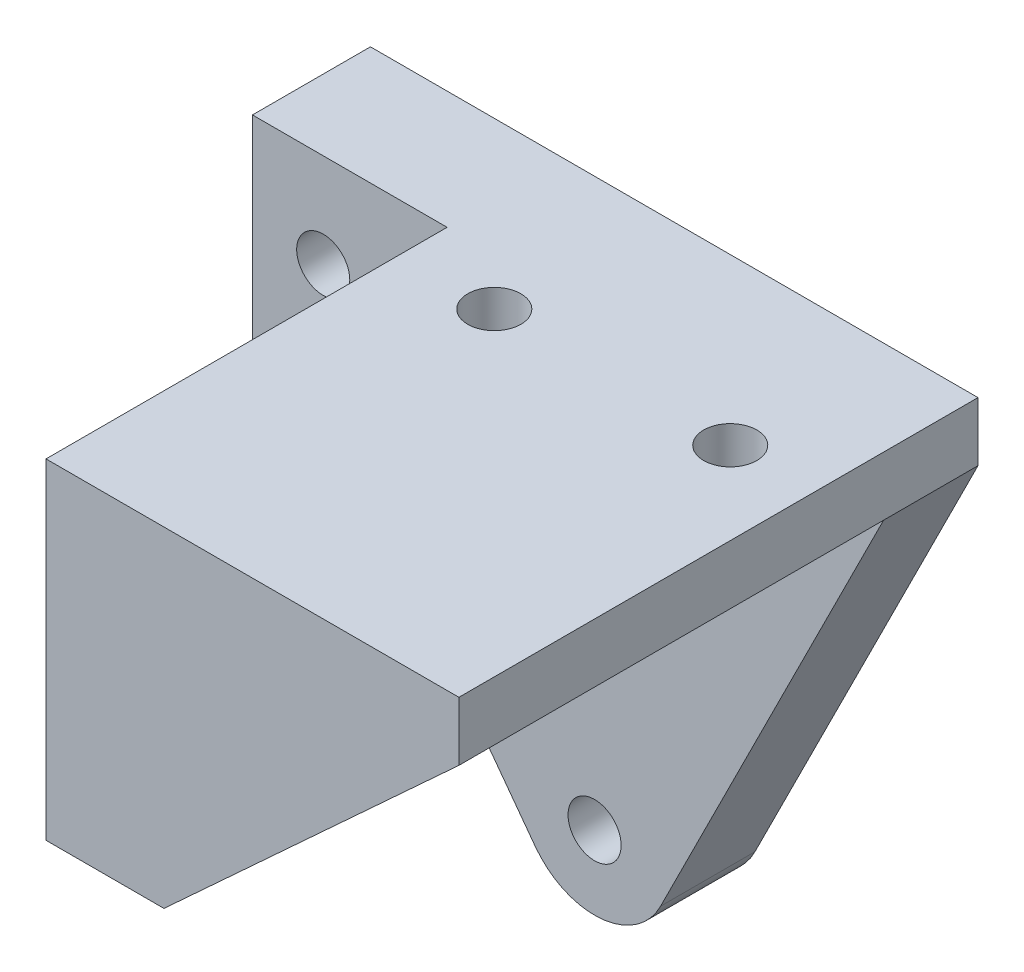
from build123d import *

# Parameters (mm, degrees)
BOSS_EXTRUDE1_DEPTH     = 28
BOSS_EXTRUDE2_DEPTH     = 12
SKETCH3_R               = 2.25
CUT_EXTRUDE1_DEPTH      = 62.565006294
SKETCH4_R               = 2.25
CUT_EXTRUDE2_DEPTH      = 56.554027757
SKETCH5_W               = 40
SKETCH5_H               = 5
BOSS_EXTRUDE3_DEPTH     = 25
CUT_EXTRUDE3_DEPTH      = 10
CUT_EXTRUDE3_DEPTH_BACK = 54.209491634
SKETCH6_R               = 2.25
SKETCH7_W               = 7
SKETCH7_H               = 5
CUT_EXTRUDE4_DEPTH      = 10
SKETCH8_R               = 2.25
BOSS_EXTRUDE4_DEPTH     = 8
BOSS_EXTRUDE6_DEPTH     = 4
SKETCH10_W              = 8
SKETCH10_H              = 28
CUT_EXTRUDE5_DEPTH      = 66.423619588


with BuildPart() as part:
    # Sketch1 → Boss-Extrude1 (new body)
    with BuildSketch(Plane(origin=(0, 0, 0), x_dir=(1, 0, 0), z_dir=(0, 1, 0))):
        Polygon((0, 0), (-26.5, 0), (-26.5, 10), (-10, 10), (-10, 40), (0, 40), align=None)
    extrude(amount=BOSS_EXTRUDE1_DEPTH)

    # Sketch2 → Boss-Extrude2 (add)
    with BuildSketch(Plane.ZY.offset(26.5)):
        with BuildLine():
            Line((0, 28), (0, 0))
            Line((0, 0), (8, 0))
            Line((8, 0), (8, 8))
            ThreePointArc((8, 8), (4, 12), (8, 16))
            Line((8, 16), (8, 28))
            Line((8, 28), (0, 28))
        make_face()
    extrude(amount=-BOSS_EXTRUDE2_DEPTH)

    # Sketch3 → Cut-Extrude1 (cut, through all)
    with BuildSketch(Plane.XY.offset(8)):
        with Locations((-20.5, 20)):
            Circle(SKETCH3_R)
        with Locations((-20.5, 4)):
            Circle(SKETCH3_R)
    extrude(amount=-CUT_EXTRUDE1_DEPTH, mode=Mode.SUBTRACT)

    # Sketch4 → Cut-Extrude2 (cut, through all)
    with BuildSketch(Plane(origin=(0, 0, 0), x_dir=(0, 0, -1), z_dir=(1, 0, 0))):
        with Locations((34, 17.5)):
            Circle(SKETCH4_R)
    extrude(amount=-CUT_EXTRUDE2_DEPTH, mode=Mode.SUBTRACT)

    # Sketch5 → Boss-Extrude3 (add)
    with BuildSketch(Plane(origin=(0, 0, 0), x_dir=(0, 0, -1), z_dir=(1, 0, 0))):
        with Locations((20, 25.5)):
            Rectangle(SKETCH5_W, SKETCH5_H)
    extrude(amount=BOSS_EXTRUDE3_DEPTH)

    # Sketch6 → Cut-Extrude3 (cut, two sides: drawn at the far end of the back side and taken through both)
    with BuildSketch(Plane.XZ.offset(-23).offset(-CUT_EXTRUDE3_DEPTH_BACK)):
        with Locations(Location((-2, -14, 0), (0, 0, 332.733955549))):
            Circle(SKETCH6_R)
        with Locations(Location((18, -14, 0), (0, 0, 90))):
            Circle(SKETCH6_R)
    extrude(amount=CUT_EXTRUDE3_DEPTH + CUT_EXTRUDE3_DEPTH_BACK, mode=Mode.SUBTRACT)

    # Sketch7 → Cut-Extrude4 (cut)
    with BuildSketch(Plane(origin=(0, 0, 0), x_dir=(0, 0, -1), z_dir=(1, 0, 0))):
        with Locations((14, 20.5)):
            Rectangle(SKETCH7_W, SKETCH7_H)
    extrude(amount=-CUT_EXTRUDE4_DEPTH, mode=Mode.SUBTRACT)

    # Sketch8 → Boss-Extrude4 (add)
    with BuildSketch(Plane.XY):
        with BuildLine():
            Line((-9.5, -9), (-4.52228171, -15.720105701))
            ThreePointArc((-4.52228171, -15.720105701), (1.041905897, -18.22646272), (6.089442895, -14.796538598))
            Line((6.089442895, -14.796538598), (25, 23))
            Line((25, 23), (0, 23))
            Line((0, 23), (0, 0))
            Line((0, 0), (-26.5, 0))
            Line((-26.5, 0), (-10.922493011, -7.804616818))
            ThreePointArc((-10.922493011, -7.804616818), (-10.14087473, -8.318566759), (-9.5, -9))
        make_face()
        with Locations((0.5, -12)):
            Circle(SKETCH8_R, mode=Mode.SUBTRACT)
    extrude(amount=-BOSS_EXTRUDE4_DEPTH)

    # Sketch9 → Boss-Extrude6 (add)
    with BuildSketch(Plane(origin=(0, 0, -40), x_dir=(-1, 0, 0), z_dir=(0, 0, -1))):
        Polygon((-25, 23), (0, 0), (10, 0), (10, 28), (-25, 28), align=None)
    extrude(amount=BOSS_EXTRUDE6_DEPTH)

    # Sketch10 → Cut-Extrude5 (cut, through all)
    with BuildSketch(Plane(origin=(-14.5, 0, 0), x_dir=(0, 0, -1), z_dir=(1, 0, 0))):
        with Locations((-4, 14)):
            Rectangle(SKETCH10_W, SKETCH10_H)
    extrude(amount=-CUT_EXTRUDE5_DEPTH, mode=Mode.SUBTRACT)


with BuildPart() as body_2:
    # Mirror1: mirrored copy
    add(part.part.mirror(Plane(origin=(0, 28, 0), x_dir=(1, 0, 0), z_dir=(0, 0, -1))))


solid = body_2.part
